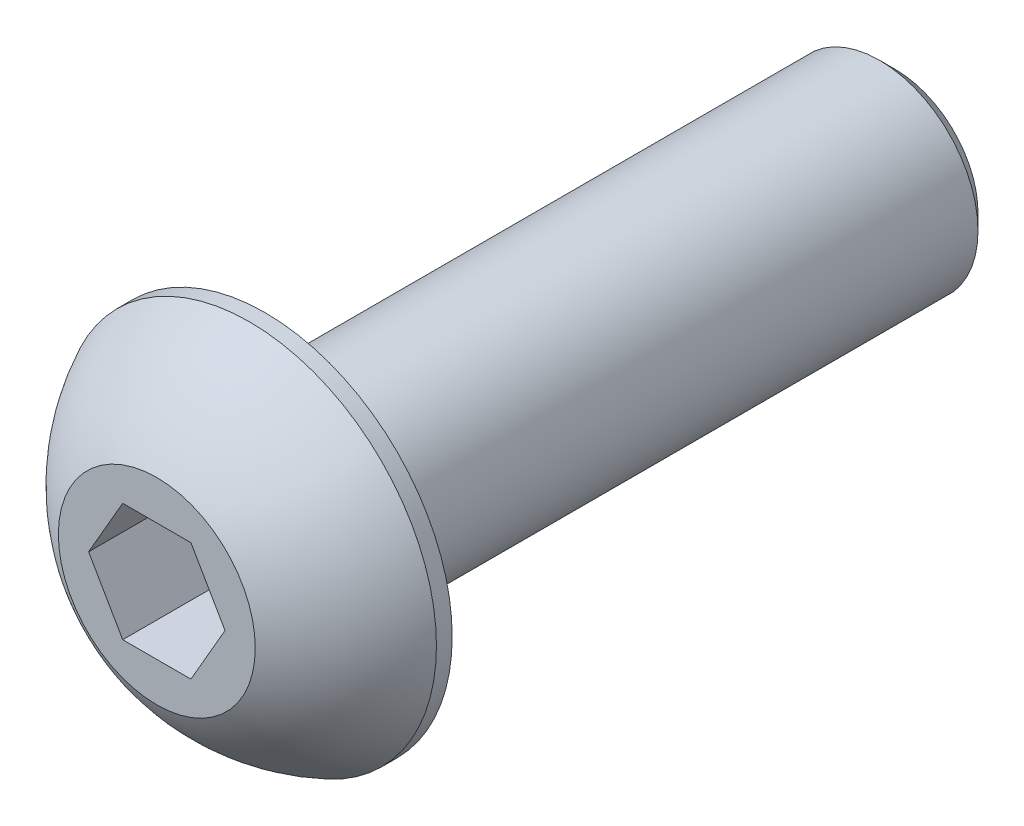
from build123d import *

# Parameters (mm, degrees)
CUT_EXTRUDE1_DEPTH = 4
CHAMFER1_SIZE      = 0.4
FILLET1_R          = 0.2


with BuildPart() as part:
    # Sketch1 → Revolve1 (revolve)
    with BuildSketch(Plane(origin=(0, 0, 0), x_dir=(0, 0, -1), z_dir=(1, 0, 0))):
        with BuildLine():
            Line((-0.4, 4.75), (0, 4.75))
            Line((0, 4.75), (0, 2.5))
            Line((0, 2.5), (16, 2.5))
            Line((16, 2.5), (16, 0))
            Line((16, 0), (-2.75, 0))
            Line((-2.75, 0), (-2.75, 2.5))
            ThreePointArc((-2.75, 2.5), (-1.752774696, 3.810675793), (-0.4, 4.75))
        make_face()
    revolve(axis=Axis((0, 0, -16), (0, 0, 1)))

    # Sketch2 → Cut-Extrude1 (cut)
    with BuildSketch(Plane.XY.offset(2.75)):
        Polygon((1.732050808, 0), (0.866025404, 1.5), (-0.866025404, 1.5), (-1.732050808, 0), (-0.866025404, -1.5), (0.866025404, -1.5), align=None)
    extrude(amount=-CUT_EXTRUDE1_DEPTH, mode=Mode.SUBTRACT)

    # Chamfer1
    chamfer1_edges = [part.edges().sort_by_distance(p)[0] for p in [
        (0, -2.5, -16),
    ]]
    chamfer(chamfer1_edges, length=CHAMFER1_SIZE)

    # Fillet1
    fillet1_edges = [part.edges().sort_by_distance(p)[0] for p in [
        (0, -2.5, 0),
    ]]
    fillet(fillet1_edges, radius=FILLET1_R)


solid = part.part
